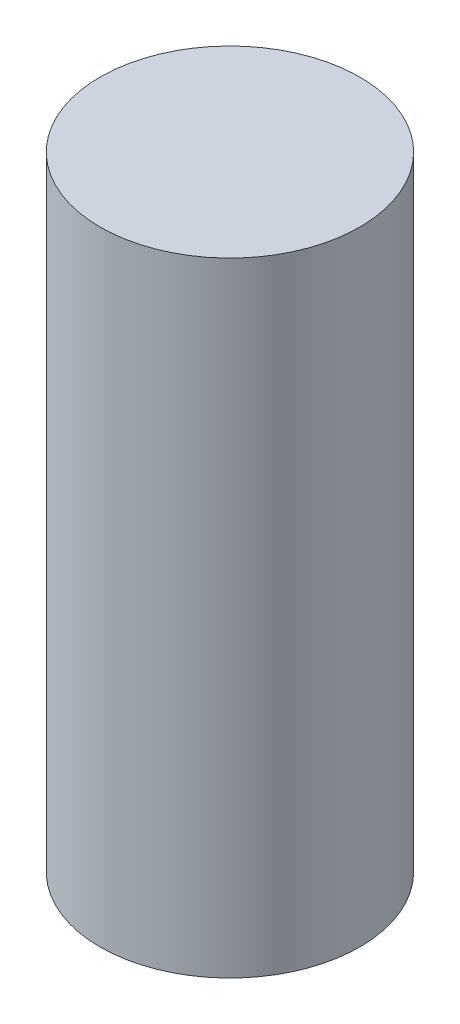
from build123d import *

# Parameters (mm, degrees)
SKETCH1_R           = 10
BOSS_EXTRUDE1_DEPTH = 48


with BuildPart() as part:
    # Sketch1 → Boss-Extrude1 (new body)
    with BuildSketch(Plane(origin=(0, 0, 0), x_dir=(1, 0, 0), z_dir=(0, 1, 0))):
        with Locations(Location((0, 0, 0), (0, 0, 270))):
            Circle(SKETCH1_R)
    extrude(amount=BOSS_EXTRUDE1_DEPTH)


solid = part.part
